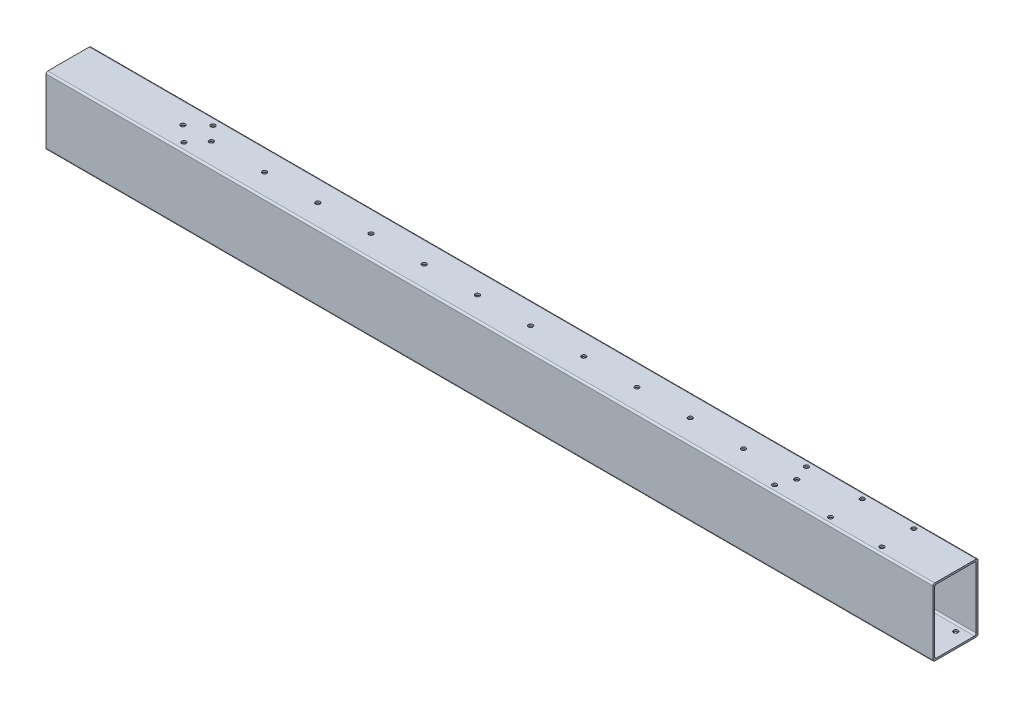
from build123d import *

# Parameters (mm, degrees)
SKETCH1_W             = 50.8
SKETCH1_H             = 76.2
BOSS_EXTRUDE1_DEPTH   = 1000
SKETCH2_W             = 46.8
SKETCH2_H             = 72.2
CUT_EXTRUDE1_DEPTH    = 1002.04783602
FILLET2_R             = 2
CROQUIS2_R            = 2.5
CORTAR_EXTRUIR2_DEPTH = 10
CROQUIS3_R            = 2.5
CORTAR_EXTRUIR3_DEPTH = 10
CROQUIS4_R            = 2.5
CORTAR_EXTRUIR4_DEPTH = 10
CROQUIS5_R            = 2.5
CORTAR_EXTRUIR5_DEPTH = 10
CROQUIS6_R            = 2.5
CORTAR_EXTRUIR6_DEPTH = 1004.220613823
MATRIZL1_COUNT        = 12
MATRIZL1_PITCH        = 60
CROQUIS7_R            = 2.5
CORTAR_EXTRUIR7_DEPTH = 10


with BuildPart() as part:
    # Sketch1 → Boss-Extrude1 (new body)
    with BuildSketch(Plane(origin=(0, 0, 0), x_dir=(0, 0, -1), z_dir=(1, 0, 0))):
        Rectangle(SKETCH1_W, SKETCH1_H)
    extrude(amount=-BOSS_EXTRUDE1_DEPTH)

    # Sketch2 → Cut-Extrude1 (cut, through all)
    with BuildSketch(Plane(origin=(0, 0, 0), x_dir=(0, 0, -1), z_dir=(1, 0, 0))):
        Rectangle(SKETCH2_W, SKETCH2_H)
    extrude(amount=-CUT_EXTRUDE1_DEPTH, mode=Mode.SUBTRACT)

    # Fillet2
    fillet2_edges = [part.edges().sort_by_distance(p)[0] for p in [
        (-500, -36.1, 23.4),
        (-500, 36.1, 23.4),
        (-500, 36.1, -23.4),
        (-500, -36.1, -23.4),
        (-500, 38.1, 25.4),
        (-500, 38.1, -25.4),
        (-500, -38.1, -25.4),
        (-500, -38.1, 25.4),
    ]]
    fillet(fillet2_edges, radius=FILLET2_R)

    # Croquis2 → Cortar-Extruir2 (cut)
    with BuildSketch(Plane.XZ.offset(38.1)):
        with Locations(Location((-61.2, 15.4, 0), (0, 0, 270))):
            Circle(CROQUIS2_R)
        with Locations(Location((-38.1, 0, 0), (0, 0, 270))):
            Circle(CROQUIS2_R)
        with Locations(Location((-61.2, -15.4, 0), (0, 0, 270))):
            Circle(CROQUIS2_R)
        with Locations(Location((-15, -15.4, 0), (0, 0, 270))):
            Circle(CROQUIS2_R)
        with Locations(Location((-15, 15.4, 0), (0, 0, 270))):
            Circle(CROQUIS2_R)
    extrude(amount=-CORTAR_EXTRUIR2_DEPTH, mode=Mode.SUBTRACT)

    # Croquis3 → Cortar-Extruir3 (cut)
    with BuildSketch(Plane.XZ.offset(38.1)):
        with Locations(Location((-985, 15.4, 0), (0, 0, 270))):
            Circle(CROQUIS3_R)
        with Locations(Location((-938.8, 15.4, 0), (0, 0, 270))):
            Circle(CROQUIS3_R)
        with Locations(Location((-961.9, 0, 0), (0, 0, 270))):
            Circle(CROQUIS3_R)
        with Locations(Location((-985, -15.4, 0), (0, 0, 270))):
            Circle(CROQUIS3_R)
        with Locations(Location((-938.8, -15.4, 0), (0, 0, 270))):
            Circle(CROQUIS3_R)
    extrude(amount=-CORTAR_EXTRUIR3_DEPTH, mode=Mode.SUBTRACT)

    # Croquis4 → Cortar-Extruir4 (cut)
    with BuildSketch(Plane(origin=(0, 38.1, 0), x_dir=(1, 0, 0), z_dir=(0, 1, 0))):
        with Locations(Location((-853.5, 16.4, 0), (0, 0, 270))):
            Circle(CROQUIS4_R)
        with Locations(Location((-853.5, -16.4, 0), (0, 0, 270))):
            Circle(CROQUIS4_R)
        with Locations(Location((-871, 0, 0), (0, 0, 270))):
            Circle(CROQUIS4_R)
    extrude(amount=-CORTAR_EXTRUIR4_DEPTH, mode=Mode.SUBTRACT)

    # Croquis5 → Cortar-Extruir5 (cut)
    with BuildSketch(Plane(origin=(0, 38.1, 0), x_dir=(1, 0, 0), z_dir=(0, 1, 0))):
        with Locations(Location((-186, 17.9, 0), (0, 0, 270))):
            Circle(CROQUIS5_R)
        with Locations(Location((-186, -17.9, 0), (0, 0, 270))):
            Circle(CROQUIS5_R)
        with Locations(Location((-123, -17.9, 0), (0, 0, 270))):
            Circle(CROQUIS5_R)
        with Locations(Location((-123, 17.9, 0), (0, 0, 270))):
            Circle(CROQUIS5_R)
        with Locations(Location((-65, 17.9, 0), (0, 0, 270))):
            Circle(CROQUIS5_R)
        with Locations(Location((-65, -17.9, 0), (0, 0, 270))):
            Circle(CROQUIS5_R)
    extrude(amount=-CORTAR_EXTRUIR5_DEPTH, mode=Mode.SUBTRACT)

    # Croquis6 → Cortar-Extruir6 (cut, through all)
    with BuildSketch(Plane(origin=(0, 38.1, 0), x_dir=(1, 0, 0), z_dir=(0, 1, 0))):
        with Locations(Location((-179, 0, 0), (0, 0, 270))):
            Circle(CROQUIS6_R)
    cortar_extruir6 = extrude(amount=-CORTAR_EXTRUIR6_DEPTH, mode=Mode.SUBTRACT)

    # MatrizL1: Cortar-Extruir6 ×12
    with Locations(*[(-i * MATRIZL1_PITCH, 0, 0) for i in range(1, MATRIZL1_COUNT)]):
        add(cortar_extruir6, mode=Mode.SUBTRACT)

    # Croquis7 → Cortar-Extruir7 (cut)
    with BuildSketch(Plane(origin=(0, 0, -25.4), x_dir=(-1, 0, 0), z_dir=(0, 0, -1))):
        with Locations(Location((75, -18.1, 0), (0, 0, 90))):
            Circle(CROQUIS7_R)
        with Locations(Location((355, -18.1, 0), (0, 0, 90))):
            Circle(CROQUIS7_R)
        with Locations(Location((635, -18.1, 0), (0, 0, 90))):
            Circle(CROQUIS7_R)
        with Locations(Location((915, -18.1, 0), (0, 0, 90))):
            Circle(CROQUIS7_R)
        with Locations(Location((265, 8.1, 0), (0, 0, 90))):
            Circle(CROQUIS7_R)
        with Locations(Location((830, 8.1, 0), (0, 0, 90))):
            Circle(CROQUIS7_R)
    extrude(amount=-CORTAR_EXTRUIR7_DEPTH, mode=Mode.SUBTRACT)


solid = part.part
